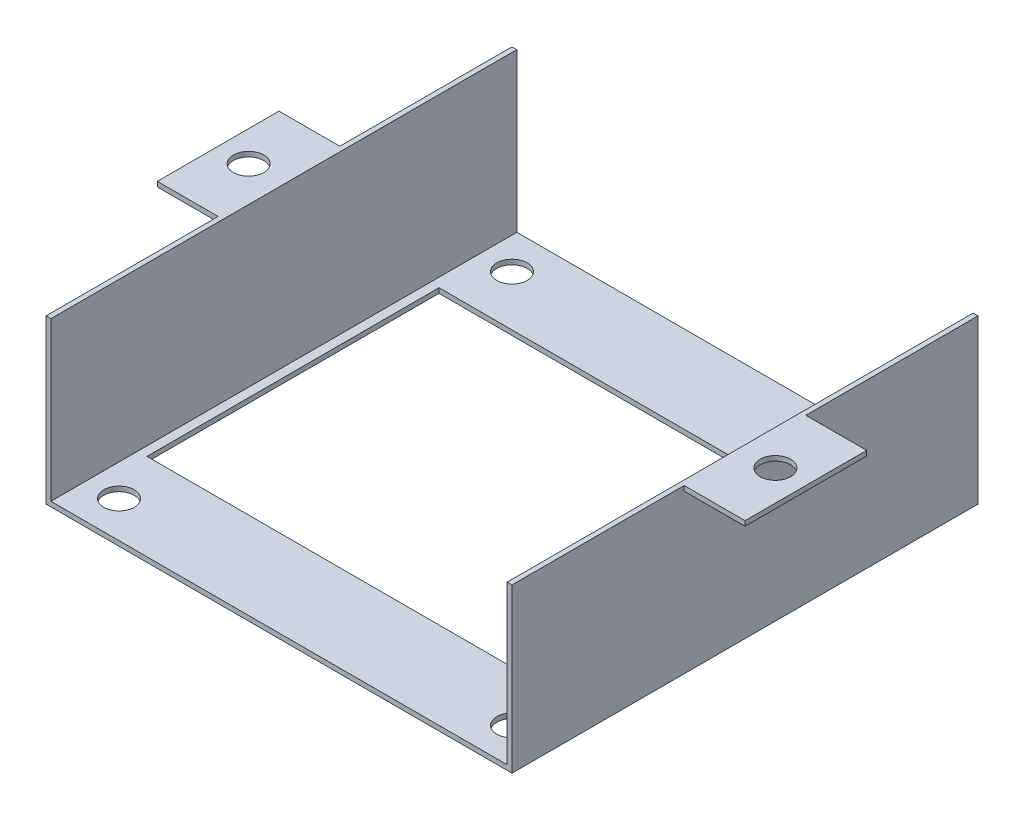
from build123d import *

# Parameters (mm, degrees)
SKETCH_1_W          = 75
SKETCH_1_H          = 75
EXTRUDE_1_DEPTH     = 0.8
SKETCH_2_W          = 76.6
SKETCH_2_H          = 76.6
SKETCH_2_W_2        = 75
SKETCH_2_H_2        = 75
EXTRUDE_2_DEPTH     = 26.8
SKETCH_3_W          = 10.8
SKETCH_3_H          = 20
EXTRUDE_3_DEPTH     = 0.8
F_5_0MM_1_D         = 5
SKETCH_6_W          = 75
SKETCH_6_H          = 26
CUT_EXTRUDE_1_DEPTH = 119.099280269
F_5_0MM_2_D         = 5


with BuildPart() as part:
    # 草图1 → 凸台-拉伸1 (new body)
    with BuildSketch(Plane(origin=(0, 0, 0), x_dir=(1, 0, 0), z_dir=(0, 1, 0))):
        with Locations((37.5, -37.5)):
            Rectangle(SKETCH_1_W, SKETCH_1_H)
        Polygon((73.5, -37.5), (73.5, -13.5), (1.5, -13.5), (1.5, -61.5), (73.5, -61.5), align=None, mode=Mode.SUBTRACT)
    extrude(amount=EXTRUDE_1_DEPTH)

    # 草图2 → 凸台-拉伸2 (add)
    with BuildSketch(Plane.XZ):
        with Locations((37.5, 37.5)):
            Rectangle(SKETCH_2_W, SKETCH_2_H)
        with Locations((37.5, 37.5)):
            Rectangle(SKETCH_2_W_2, SKETCH_2_H_2, mode=Mode.SUBTRACT)
    extrude(amount=-EXTRUDE_2_DEPTH)

    # 草图3 → 凸台-拉伸3 (add)
    with BuildSketch(Plane(origin=(0, 26.8, 0), x_dir=(1, 0, 0), z_dir=(0, 1, 0))):
        with Locations((-5.4, -37.5)):
            Rectangle(SKETCH_3_W, SKETCH_3_H)
        with Locations((80.4, -37.5)):
            Rectangle(SKETCH_3_W, SKETCH_3_H)
    extrude(amount=-EXTRUDE_3_DEPTH)

    # Ø5.0mm 暗销孔1 (through all)
    with Locations(Plane(origin=(0, 26.8, 0), x_dir=(1, 0, 0), z_dir=(0, 1, 0))):
        with Locations((80.8, -37.5), (-5.8, -37.5)):
            Hole(F_5_0MM_1_D / 2)

    # 草图6 → 切除-拉伸1 (cut, through all)
    with BuildSketch(Plane.XY.offset(75.8)):
        with Locations((37.5, 13.8)):
            Rectangle(SKETCH_6_W, SKETCH_6_H)
    extrude(amount=-CUT_EXTRUDE_1_DEPTH, mode=Mode.SUBTRACT)

    # Ø5.0mm 暗销孔2 (through all)
    with Locations(Plane(origin=(0, 0, 0), x_dir=(-1, 0, 0), z_dir=(0, -1, 0))):
        with Locations((-69.8, -69.8), (-69.8, -5.2), (-5.2, -5.2), (-5.2, -69.8)):
            Hole(F_5_0MM_2_D / 2)


solid = part.part
